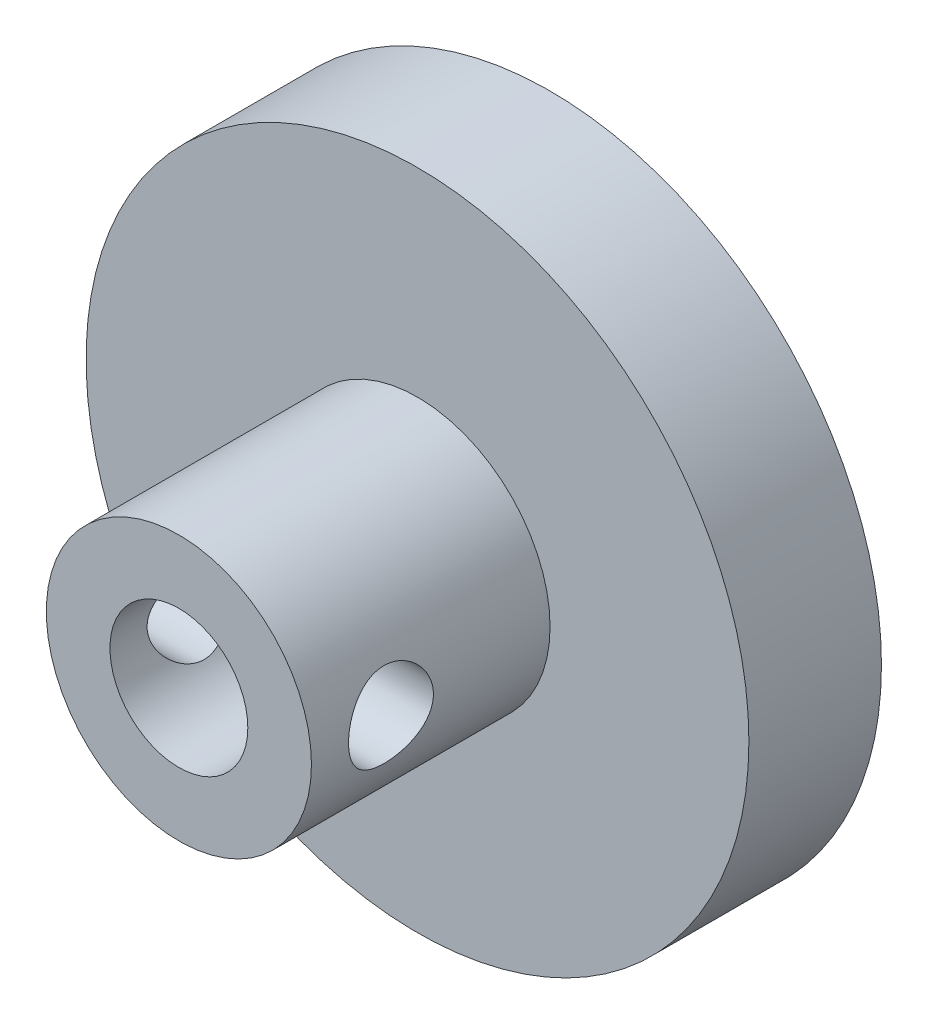
from build123d import *

# Parameters (mm, degrees)
SKETCH_1_R               = 12.5
SKETCH_1_R_2             = 2.6
EXTRUDE_1_DEPTH          = 5
SKETCH_1_4_R             = 5
SKETCH_1_4_R_2           = 2.6
EXTRUDE_2_DEPTH          = 14
CUT_EXTRUDE_1_DEPTH      = 10
CUT_EXTRUDE_1_DEPTH_BACK = 10
SKETCH_2_R               = 1.6


with BuildPart() as part:
    # 草图1 → 凸台-拉伸1 (new body)
    with BuildSketch(Plane.XY):
        Circle(SKETCH_1_R)
        Circle(SKETCH_1_R_2, mode=Mode.SUBTRACT)
    extrude(amount=EXTRUDE_1_DEPTH)

    # 草图1<4> → 凸台-拉伸2 (add)
    with BuildSketch(Plane.XY):
        Circle(SKETCH_1_4_R)
        Circle(SKETCH_1_4_R_2, mode=Mode.SUBTRACT)
    extrude(amount=EXTRUDE_2_DEPTH)

    # 草图2 → 切除-拉伸1 (cut, two sides: drawn at the far end of the back side and taken through both)
    with BuildSketch(Plane(origin=(0, 0, 0), x_dir=(0, 0, -1), z_dir=(1, 0, 0)).offset(-CUT_EXTRUDE_1_DEPTH_BACK)):
        with Locations(Location((-11, 0, 0), (0, 0, 180))):
            Circle(SKETCH_2_R)
    extrude(amount=CUT_EXTRUDE_1_DEPTH + CUT_EXTRUDE_1_DEPTH_BACK, mode=Mode.SUBTRACT)


solid = part.part
